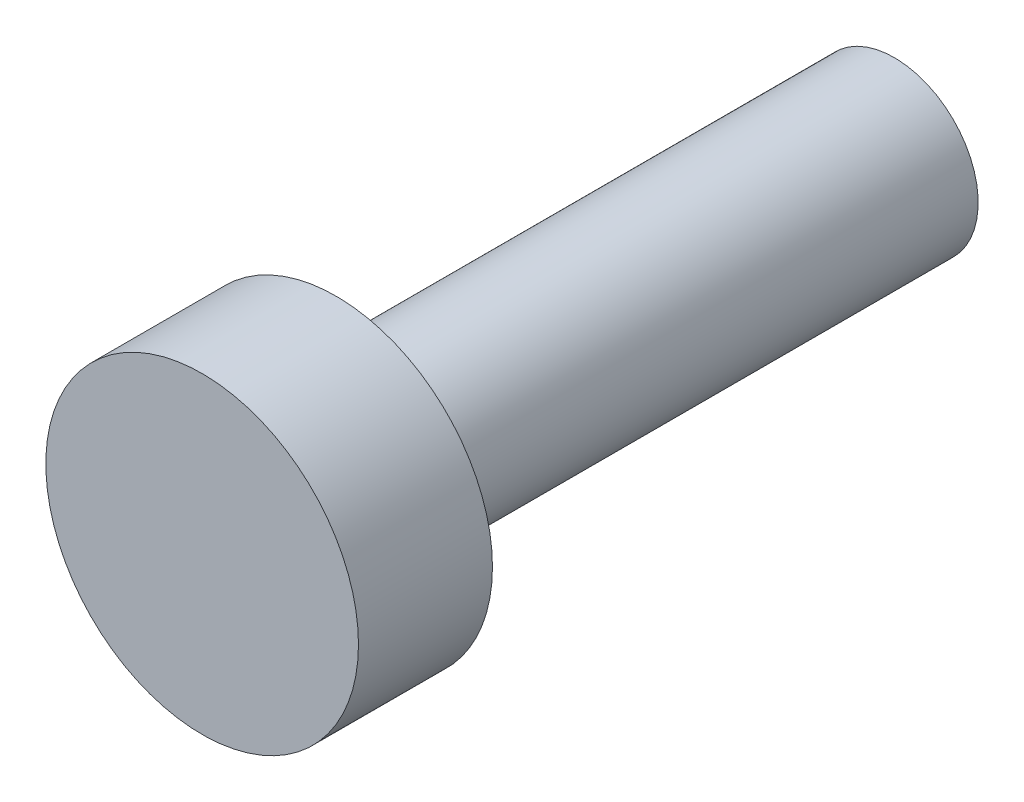
from build123d import *

# Parameters (mm, degrees)
ESQUISSE1_R        = 2.8
BOSS_EXTRU_1_DEPTH = 2.4
ESQUISSE2_R        = 1.5
BOSS_EXTRU_2_DEPTH = 10


with BuildPart() as part:
    # Esquisse1 → Boss.-Extru.1 (new body)
    with BuildSketch(Plane.XY):
        Circle(ESQUISSE1_R)
    extrude(amount=BOSS_EXTRU_1_DEPTH)

    # Esquisse2 → Boss.-Extru.2 (add)
    with BuildSketch(Plane(origin=(0, 0, 0), x_dir=(-1, 0, 0), z_dir=(0, 0, -1))):
        Circle(ESQUISSE2_R)
    extrude(amount=BOSS_EXTRU_2_DEPTH)


solid = part.part
